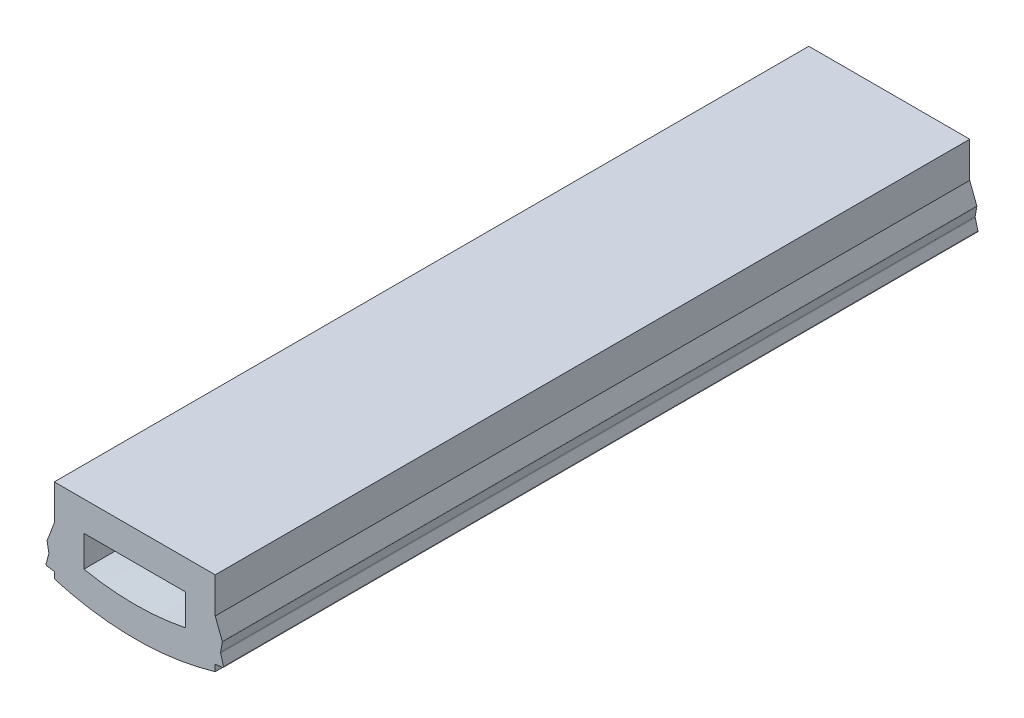
from build123d import *

# Parameters (mm, degrees)
BOSS_EXTRUDE2_DEPTH = 150
CUT_EXTRUDE1_DEPTH  = 179.003087993
CUT_EXTRUDE1_DRAFT  = 0.75
BOSS_EXTRUDE3_DEPTH = 150


with BuildPart() as part:
    # Sketch1 → Boss-Extrude2 (new body)
    with BuildSketch(Plane.XY):
        with BuildLine():
            Line((-15.957671772, -92.173910335), (-15.957671772, -75.48673473))
            Line((-15.957671772, -75.48673473), (16.042328228, -75.48673473))
            Line((16.042328228, -75.48673473), (16.042328228, -92.173910335))
            ThreePointArc((16.042328228, -92.173910335), (0.042328228, -94.48673473), (-15.957671772, -92.173910335))
        make_face()
    extrude(amount=-BOSS_EXTRUDE2_DEPTH)


with BuildPart() as cut_extrude1_tool:
    # Sketch4 → Cut-Extrude1 (with draft: the straight prism first)
    with BuildSketch(Plane.XY):
        with BuildLine():
            Line((10.142328228, -87.568485405), (10.142328228, -81.38673473))
            Line((10.142328228, -81.38673473), (-10.057671772, -81.38673473))
            Line((-10.057671772, -81.38673473), (-10.057671772, -87.568485405))
            ThreePointArc((-10.057671772, -87.568485405), (0.042328228, -88.58673473), (10.142328228, -87.568485405))
        make_face()
    extrude(amount=-CUT_EXTRUDE1_DEPTH)
    # Cut-Extrude1: the draft: its side faces are tilted about the plane it starts from
    cut_extrude1_sides = [cut_extrude1_tool.faces().sort_by_distance(p)[0] for p in [
        (0.042328228, -88.58673473, -89.501543996),
        (10.142328228, -84.477610068, -89.501543996),
        (0.042328228, -81.38673473, -89.501543996),
        (-10.057671772, -84.477610068, -89.501543996),
    ]]
    draft(cut_extrude1_sides, Plane.XY, CUT_EXTRUDE1_DRAFT)


with BuildPart() as part_1:
    add(part.part)

    # Cut-Extrude1: cut by cut_extrude1_tool
    add(cut_extrude1_tool.part, mode=Mode.SUBTRACT)

    # Sketch5 → Boss-Extrude3 (add)
    with BuildSketch(Plane(origin=(0, 0, -150), x_dir=(-1, 0, 0), z_dir=(0, 0, -1))):
        with BuildLine():
            Line((-17.509626323, -90.700736876), (-16.042328228, -90.893910335))
            Line((-16.042328228, -90.893910335), (-16.042328228, -82.570693355))
            Line((-16.042328228, -82.570693355), (-17.447829646, -86.253845746))
            ThreePointArc((-17.447829646, -86.253845746), (-17.46006126, -86.306080257), (-17.457968161, -86.359686931))
            Line((-17.457968161, -86.359686931), (-17.126211232, -88.252050567))
            ThreePointArc((-17.126211232, -88.252050567), (-17.120591762, -88.338766729), (-17.133832096, -88.424650167))
            Line((-17.133832096, -88.424650167), (-17.67670625, -90.450684094))
            ThreePointArc((-17.67670625, -90.450684094), (-17.649815007, -90.61356195), (-17.509626323, -90.700736876))
        make_face()
        with BuildLine():
            Line((15.957671772, -90.893910335), (15.957671772, -82.570693355))
            Line((15.957671772, -82.570693355), (17.36317319, -86.253845746))
            ThreePointArc((17.36317319, -86.253845746), (17.375404804, -86.306080257), (17.373311704, -86.359686931))
            Line((17.373311704, -86.359686931), (17.041554775, -88.252050567))
            ThreePointArc((17.041554775, -88.252050567), (17.035935306, -88.338766729), (17.049175639, -88.424650167))
            Line((17.049175639, -88.424650167), (17.592049794, -90.450684094))
            ThreePointArc((17.592049794, -90.450684094), (17.565158551, -90.61356195), (17.424969867, -90.700736876))
            Line((17.424969867, -90.700736876), (15.957671772, -90.893910335))
        make_face()
    extrude(amount=-BOSS_EXTRUDE3_DEPTH)


solid = part_1.part
